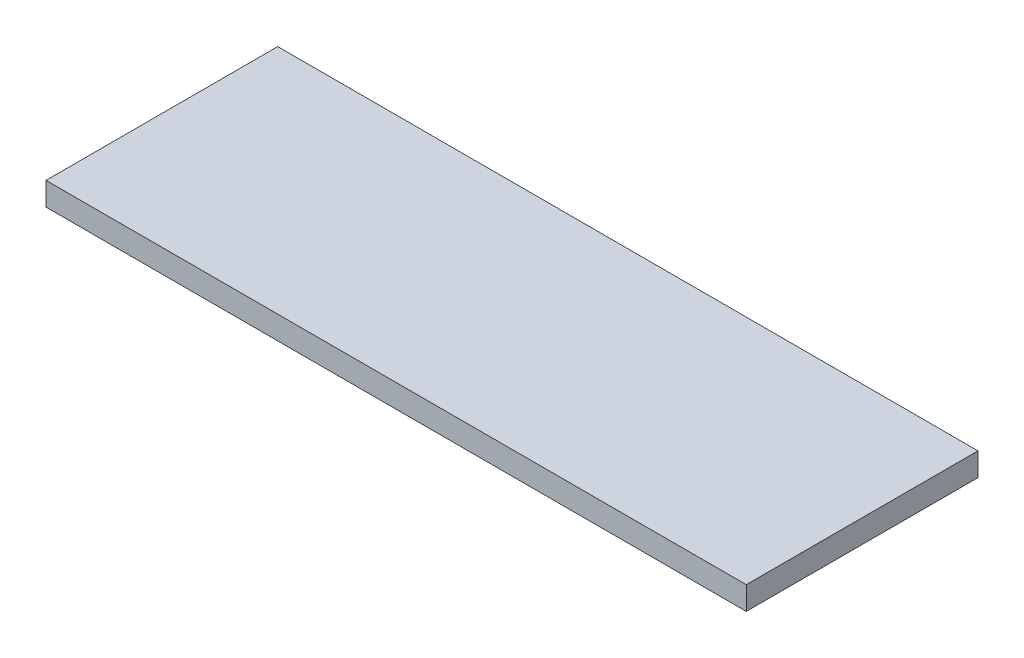
from build123d import *

# Parameters (mm, degrees)
SKETCH1_W           = 250
SKETCH1_H           = 40
BOSS_EXTRUDE1_DEPTH = 4
SKETCH3_W           = 133.971028747
SKETCH3_H           = 79.30195032
CUT_EXTRUDE2_DEPTH  = 10


with BuildPart() as part:
    # Sketch1 → Boss-Extrude1 (new body)
    with BuildSketch(Plane(origin=(0, 0, 0), x_dir=(1, 0, 0), z_dir=(0, 1, 0))):
        with Locations((-25.628547234, -36.520233304)):
            Rectangle(SKETCH1_W, SKETCH1_H)
    extrude(amount=BOSS_EXTRUDE1_DEPTH)

    # Sketch3 → Cut-Extrude2 (cut)
    with BuildSketch(Plane(origin=(0, 4, 0), x_dir=(1, 0, 0), z_dir=(0, 1, 0))):
        with Locations((37.238263367, -44.752818728)):
            Rectangle(SKETCH3_W, SKETCH3_H)
    extrude(amount=-CUT_EXTRUDE2_DEPTH, mode=Mode.SUBTRACT)


solid = part.part
